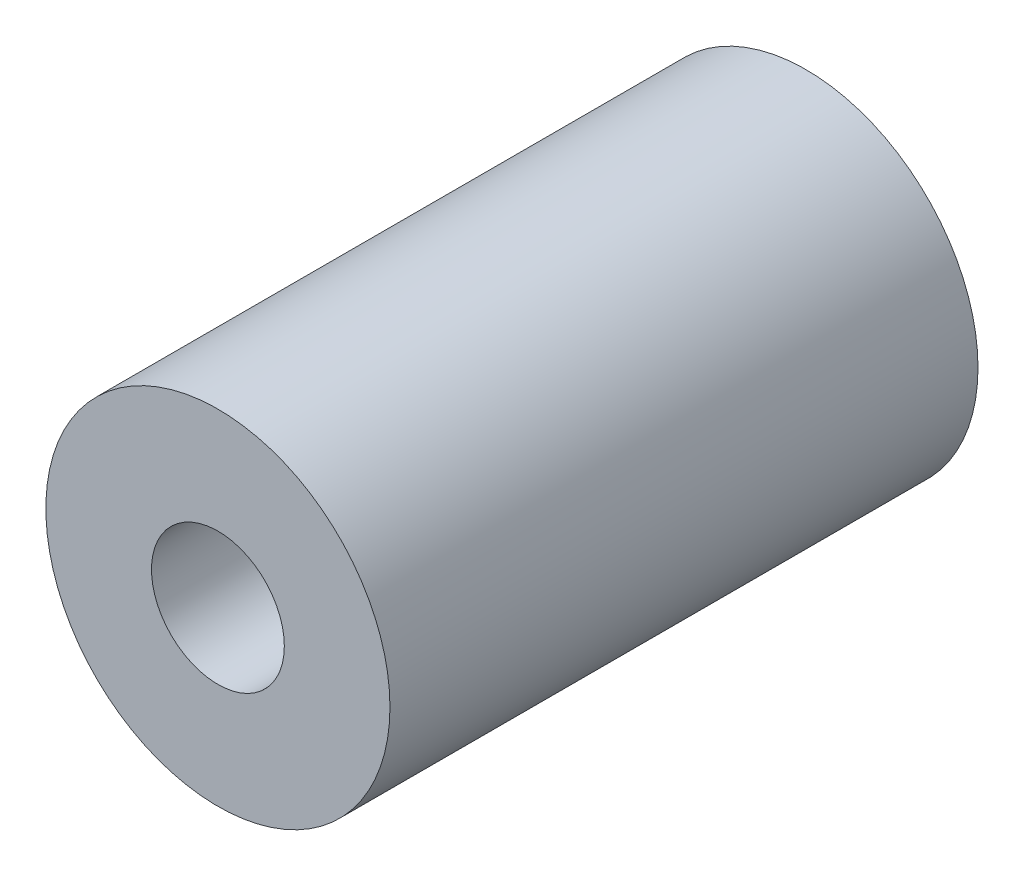
from build123d import *

# Parameters (mm, degrees)
SKETCH1_R           = 3.95
SKETCH1_R_2         = 1.525
BOSS_EXTRUDE1_DEPTH = 6.75


with BuildPart() as part:
    # Sketch1 → Boss-Extrude1 (new, symmetric)
    with BuildSketch(Plane.XY):
        Circle(SKETCH1_R)
        Circle(SKETCH1_R_2, mode=Mode.SUBTRACT)
    extrude(amount=BOSS_EXTRUDE1_DEPTH, both=True)


solid = part.part
